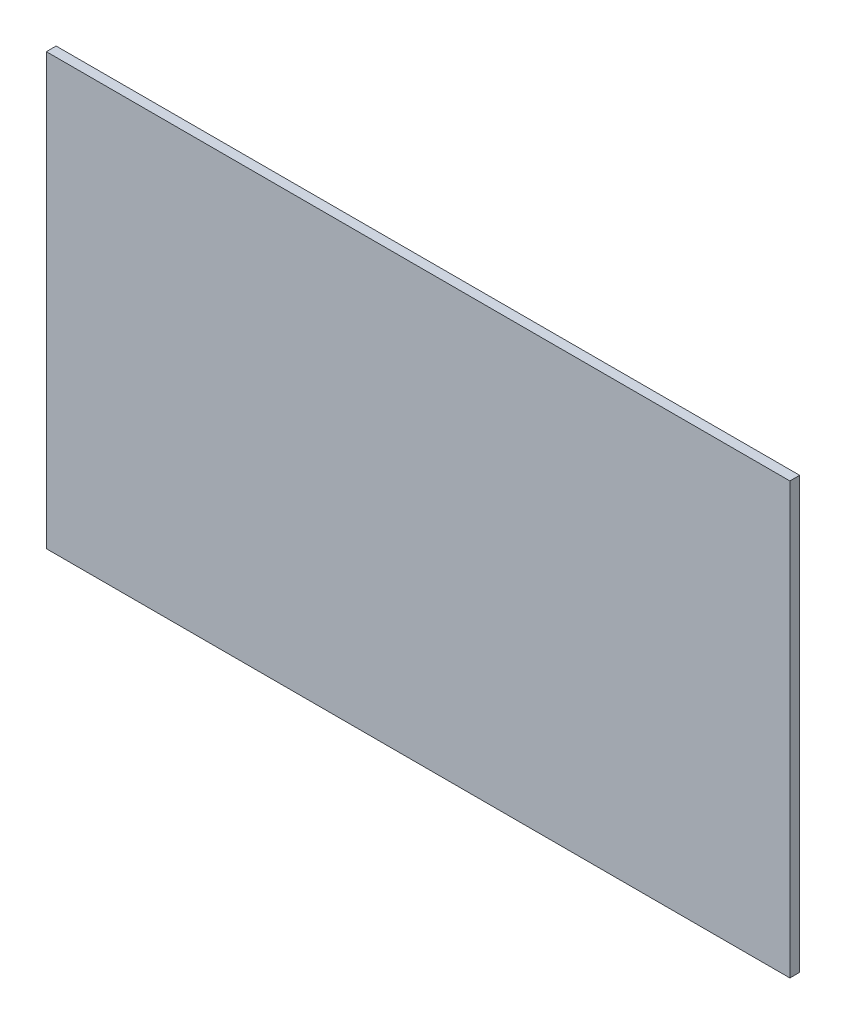
from build123d import *

# Parameters (mm, degrees)
ESQUISSE1_W        = 380
ESQUISSE1_H        = 220
BOSS_EXTRU_1_DEPTH = 5


with BuildPart() as part:
    # Esquisse1 → Boss.-Extru.1 (new body)
    with BuildSketch(Plane.XY):
        with Locations((0.342743613, -31.307106599)):
            Rectangle(ESQUISSE1_W, ESQUISSE1_H)
    extrude(amount=BOSS_EXTRU_1_DEPTH)


solid = part.part
